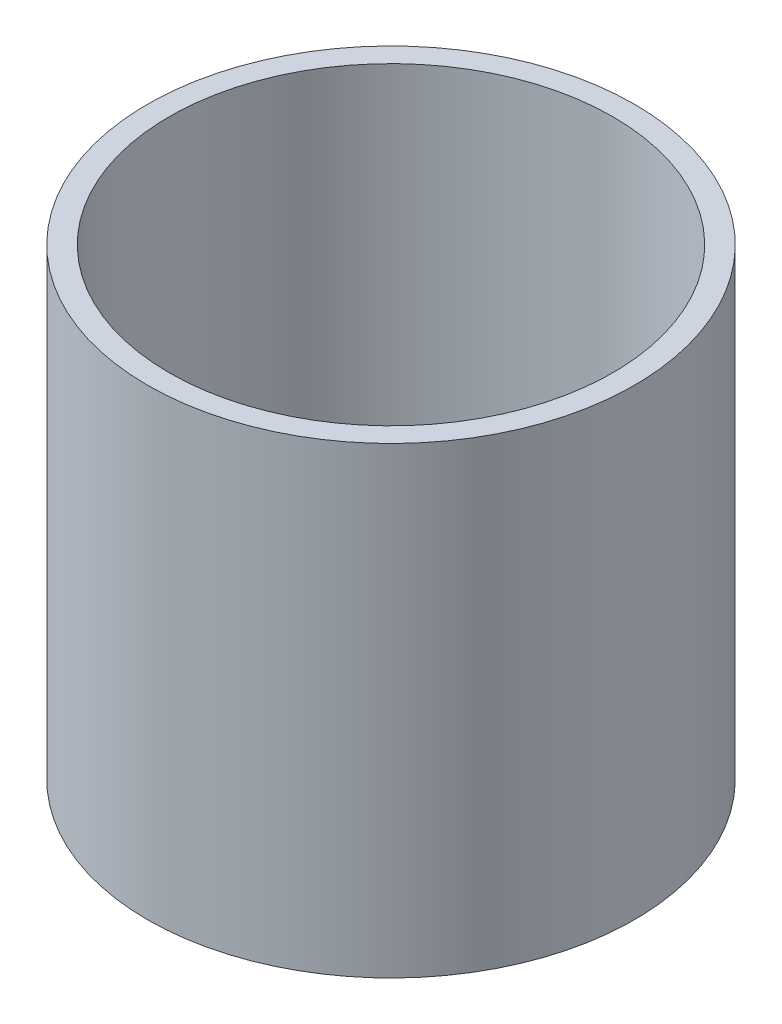
from build123d import *

# Parameters (mm, degrees)
SKETCH1_R           = 31.55
BOSS_EXTRUDE1_DEPTH = 10
SKETCH3_R           = 4.15
CUT_EXTRUDE1_DEPTH  = 10
SKETCH5_R           = 31.55
SKETCH5_R_2         = 28.75
BOSS_EXTRUDE2_DEPTH = 50


with BuildPart() as part:
    # Sketch1 → Boss-Extrude1 (new body)
    with BuildSketch(Plane(origin=(0, 0, 0), x_dir=(1, 0, 0), z_dir=(0, 1, 0))):
        with Locations(Location((0, 0, 0), (0, 0, 270))):
            Circle(SKETCH1_R)
    extrude(amount=BOSS_EXTRUDE1_DEPTH)

    # Sketch3 → Cut-Extrude1 (cut)
    with BuildSketch(Plane(origin=(0, 10, 0), x_dir=(1, 0, 0), z_dir=(0, 1, 0))):
        with Locations(Location((-18.765, 0, 0), (0, 0, 270))):
            Circle(SKETCH3_R)
        with Locations(Location((18.765, 0, 0), (0, 0, 270))):
            Circle(SKETCH3_R)
    extrude(amount=-CUT_EXTRUDE1_DEPTH, mode=Mode.SUBTRACT)

    # Sketch5 → Boss-Extrude2 (add)
    with BuildSketch(Plane(origin=(0, 10, 0), x_dir=(1, 0, 0), z_dir=(0, 1, 0))):
        with Locations(Location((0, 0, 0), (0, 0, 270))):
            Circle(SKETCH5_R)
        with Locations(Location((0, 0, 0), (0, 0, 270))):
            Circle(SKETCH5_R_2, mode=Mode.SUBTRACT)
    extrude(amount=BOSS_EXTRUDE2_DEPTH)


solid = part.part
